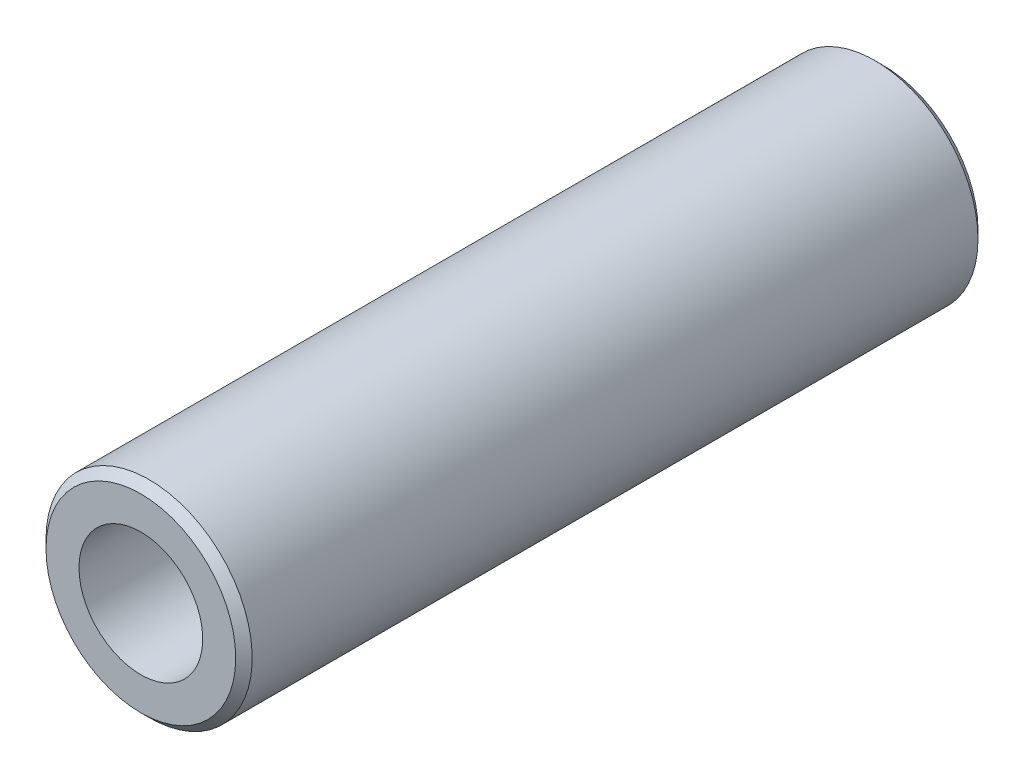
from build123d import *

# Parameters (mm, degrees)
SKETCH1_R           = 6.25
SKETCH1_R_2         = 3.75
EXTRUDE_THIN1_DEPTH = 22.5
CHAMFER1_SIZE       = 0.5


with BuildPart() as part:
    # Sketch1 → Extrude-Thin1 (new, symmetric)
    with BuildSketch(Plane.XY):
        Circle(SKETCH1_R)
        Circle(SKETCH1_R_2, mode=Mode.SUBTRACT)
    extrude(amount=EXTRUDE_THIN1_DEPTH, both=True)

    # Chamfer1
    chamfer1_edges = [part.edges().sort_by_distance(p)[0] for p in [
        (-6.25, 0, -22.5),
        (-6.25, 0, 22.5),
    ]]
    chamfer(chamfer1_edges, length=CHAMFER1_SIZE)


solid = part.part
